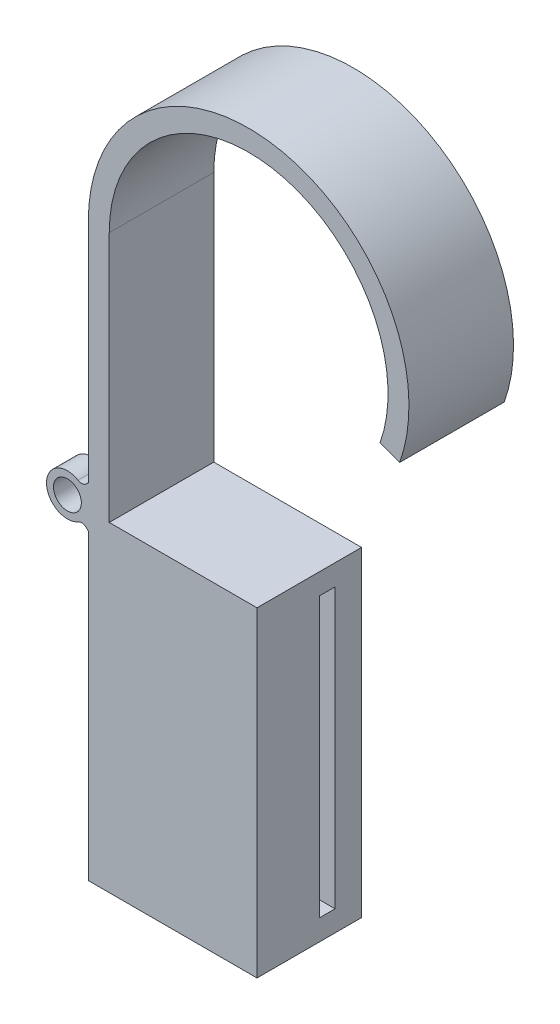
from build123d import *

# Parameters (mm, degrees)
CROQUIS1_W              = 10.6
CROQUIS1_H              = 20
SALIENTE_EXTRUIR1_DEPTH = 1.5
SALIENTE_EXTRUIR2_DEPTH = 7.5
CROQUIS23_W             = 1.1
CROQUIS23_H             = 20
CORTAR_EXTRUIR1_DEPTH   = 25.710524074
SALIENTE_EXTRUIR3_DEPTH = 7.5
CROQUIS25_R             = 1
SALIENTE_EXTRUIR5_DEPTH = 7.5
CROQUIS26_W             = 6.08430057
CROQUIS26_H             = 4
CORTAR_EXTRUIR2_DEPTH   = 7.5
CROQUIS27_W             = 1
CROQUIS27_H             = 2.2
SALIENTE_EXTRUIR6_DEPTH = 3
REDONDEO1_R             = 1
CROQUIS28_R             = 0.5
CORTAR_EXTRUIR3_DEPTH   = 5


with BuildPart() as part:
    # Croquis1 → Saliente-Extruir1 (new body)
    with BuildSketch(Plane.XY):
        with Locations((5.3, 10)):
            Rectangle(CROQUIS1_W, CROQUIS1_H)
    extrude(amount=SALIENTE_EXTRUIR1_DEPTH)

    # Croquis22 → Saliente-Extruir2 (add)
    with BuildSketch(Plane.XY.offset(1.5)):
        Polygon((0, -1.5), (12.1, -1.5), (12.1, 21.5), (0, 21.5), (0, 20), (10.6, 20), (10.6, 0), (0, 0), align=None)
    extrude(amount=-SALIENTE_EXTRUIR2_DEPTH)

    # Croquis23 → Cortar-Extruir1 (cut, through all)
    with BuildSketch(Plane.ZY.offset(-10.6)):
        with Locations((-3.55, 10)):
            Rectangle(CROQUIS23_W, CROQUIS23_H)
    extrude(amount=-CORTAR_EXTRUIR1_DEPTH, mode=Mode.SUBTRACT)

    # Croquis24 → Saliente-Extruir3 (add)
    with BuildSketch(Plane(origin=(0, 0, -6), x_dir=(-1, 0, 0), z_dir=(0, 0, -1))):
        with BuildLine():
            Line((-1.5, 21.5), (-1.5, 39.5))
            ThreePointArc((-1.5, 39.5), (-13.200559707, 49.354344051), (-20.921619337, 36.148419914))
            Line((-20.921619337, 36.148419914), (-22.334862237, 35.645682901))
            ThreePointArc((-22.334862237, 35.645682901), (-13.455643663, 50.832495659), (0, 39.5))
            Line((0, 39.5), (0, 21.5))
            Line((0, 21.5), (-1.5, 21.5))
        make_face()
    extrude(amount=-SALIENTE_EXTRUIR3_DEPTH)

    # Croquis25 → Saliente-Extruir5 (add)
    with BuildSketch(Plane(origin=(0, 0, -6), x_dir=(-1, 0, 0), z_dir=(0, 0, -1))):
        with BuildLine():
            Line((0, 20.21354083), (0, 23.21354083))
            Line((0, 23.21354083), (0.130693606, 23.082847224))
            ThreePointArc((0.130693606, 23.082847224), (0.421244851, 22.940385766), (0.738185248, 23.005685668))
            ThreePointArc((0.738185248, 23.005685668), (3, 21.71354083), (0.738185248, 20.421395992))
            ThreePointArc((0.738185248, 20.421395992), (0.421244851, 20.486695894), (0.130693606, 20.344234436))
            Line((0.130693606, 20.344234436), (0, 20.21354083))
        make_face()
        with Locations((1.5, 21.71354083)):
            Circle(CROQUIS25_R, mode=Mode.SUBTRACT)
    extrude(amount=-SALIENTE_EXTRUIR5_DEPTH)

    # Croquis26 → Cortar-Extruir2 (cut)
    with BuildSketch(Plane.XZ.offset(-20)):
        with Locations((-3.042150285, -2.25)):
            Rectangle(CROQUIS26_W, CROQUIS26_H)
    extrude(amount=-CORTAR_EXTRUIR2_DEPTH, mode=Mode.SUBTRACT)

    # Croquis27 → Saliente-Extruir6 (add)
    with BuildSketch(Plane.ZY):
        with Locations((-2.25, 35.170410703)):
            Rectangle(CROQUIS27_W, CROQUIS27_H)
    extrude(amount=SALIENTE_EXTRUIR6_DEPTH)

    # Redondeo1
    redondeo1_edges = [part.edges().sort_by_distance(p)[0] for p in [
        (-3, 34.070410703, -2.25),
        (-3, 36.270410703, -2.25),
    ]]
    fillet(redondeo1_edges, radius=REDONDEO1_R)

    # Croquis28 → Cortar-Extruir3 (cut)
    with BuildSketch(Plane.XY.offset(-1.75)):
        with Locations((-2, 35.170410703)):
            Circle(CROQUIS28_R)
    extrude(amount=-CORTAR_EXTRUIR3_DEPTH, mode=Mode.SUBTRACT)


solid = part.part
